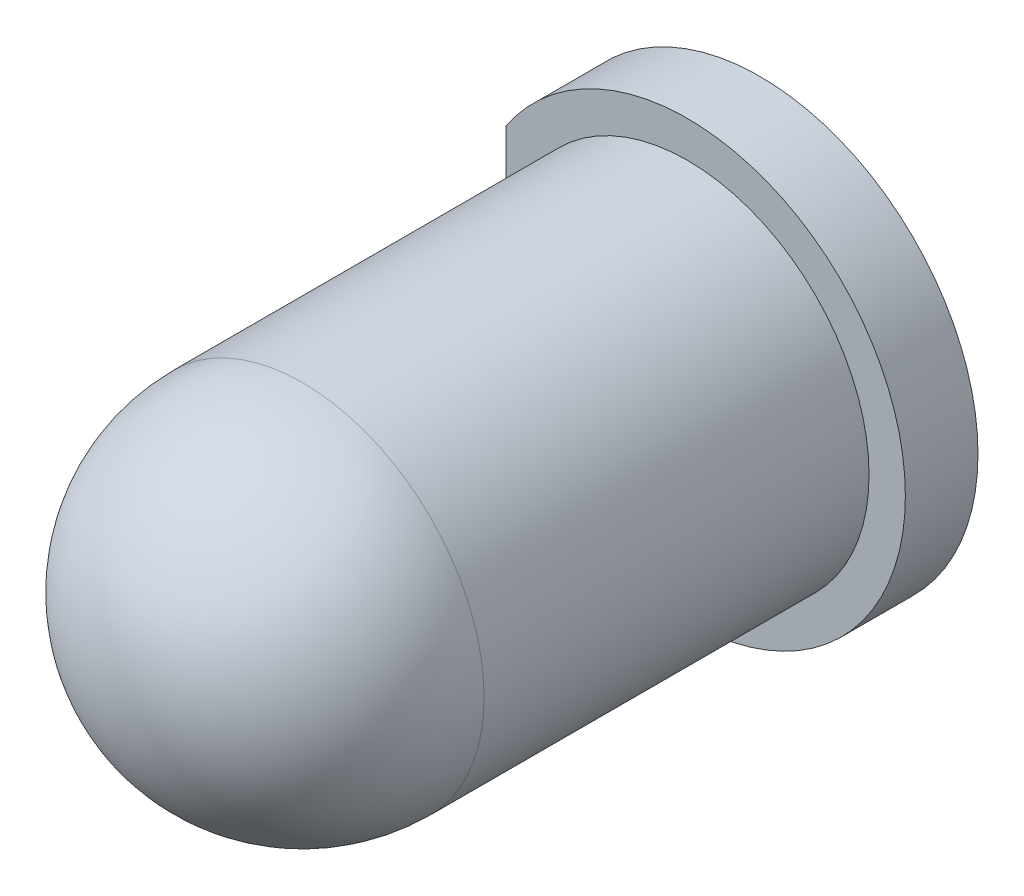
from build123d import *

# Parameters (mm, degrees)
ESBO_O1_R                = 3
RESSALTO_EXTRUS_O1_DEPTH = 1
CORTE_EXTRUS_O1_DEPTH    = 1


with BuildPart() as part:
    # Esboço1 → Ressalto-extrusão1 (new body)
    with BuildSketch(Plane.XY):
        Circle(ESBO_O1_R)
    extrude(amount=RESSALTO_EXTRUS_O1_DEPTH)

    # Esboço3 → Revolução1 (revolve)
    with BuildSketch(Plane(origin=(0, 0, 0), x_dir=(0, 0, -1), z_dir=(1, 0, 0))):
        with BuildLine():
            Line((-1, 0), (-8.8, 0))
            ThreePointArc((-8.8, 0), (-8.067766953, 1.767766953), (-6.3, 2.5))
            Line((-6.3, 2.5), (-1, 2.5))
            Line((-1, 2.5), (-1, 0))
        make_face()
    revolve(axis=Axis((0, 0, 1), (0, 0, 1)))

    # Esboço4 → Corte-extrusão1 (cut)
    with BuildSketch(Plane(origin=(0, 0, 0), x_dir=(-1, 0, 0), z_dir=(0, 0, -1))):
        with BuildLine():
            Line((2.5, 1.658312395), (2.5, -1.658312395))
            ThreePointArc((2.5, -1.658312395), (3, 0), (2.5, 1.658312395))
        make_face()
    extrude(amount=-CORTE_EXTRUS_O1_DEPTH, mode=Mode.SUBTRACT)


solid = part.part
